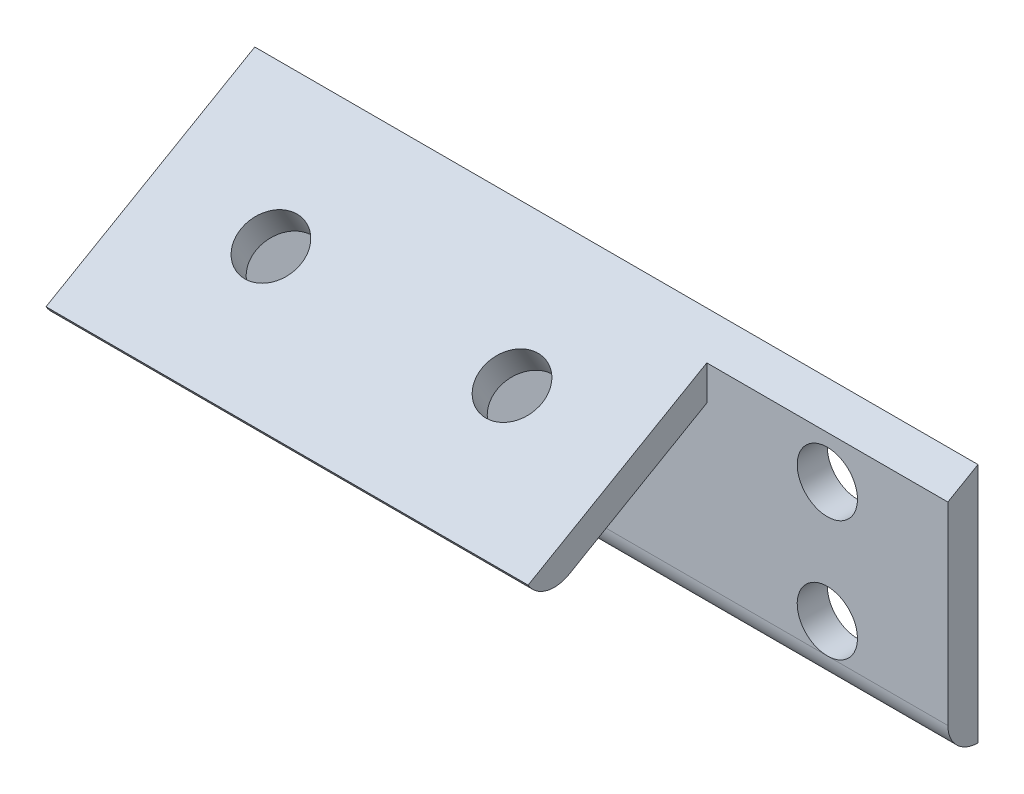
from build123d import *

# Parameters (mm, degrees)
BOSS_EXTRUDE1_DEPTH             = 76.2
CUT_EXTRUDE2_REACH              = 85.279
SKETCH3_W                       = 25.4
SKETCH3_H                       = 25.4
F_1_4_0_25_DIAMETER_HOLE1_D     = 6.35
F_1_4_0_25_DIAMETER_HOLE2_D     = 6.35
F_1_4_0_25_DIAMETER_HOLE2_DEPTH = 3.175


with BuildPart() as part:
    # Sketch1 → Boss-Extrude1 (new body)
    with BuildSketch(Plane(origin=(0, 0, 0), x_dir=(0, 0, -1), z_dir=(1, 0, 0))):
        with BuildLine():
            Line((0, 0), (0, -25.4))
            ThreePointArc((0, -25.4), (-2.24506403, -24.47006403), (-3.175, -22.225))
            Line((-3.175, -22.225), (-3.175, -5.499261314))
            Line((-3.175, -5.499261314), (-17.659914599, -13.862130657))
            ThreePointArc((-17.659914599, -13.862130657), (-20.069165067, -14.179314498), (-21.997045256, -12.7))
            Line((-21.997045256, -12.7), (0, 0))
        make_face()
    extrude(amount=BOSS_EXTRUDE1_DEPTH)

    # Sketch3 → Cut-Extrude2 (cut, up to next)
    with BuildSketch(Plane(origin=(0, 0, 0), x_dir=(1, 0, 0), z_dir=(0, 1, 0)), mode=Mode.PRIVATE) as cut_extrude2_sk1:
        with Locations((63.5, -15.875)):
            Rectangle(SKETCH3_W, SKETCH3_H)
    cut_extrude2_tool1 = extrude(cut_extrude2_sk1.sketch, amount=-CUT_EXTRUDE2_REACH, mode=Mode.PRIVATE) & part.part
    add(cut_extrude2_tool1.solids().sort_by_distance((63.5, 0, 15.875))[0], mode=Mode.SUBTRACT)

    # 1/4 (0.25) Diameter Hole1 (through all)
    with Locations(Plane.XY.offset(3.175)):
        with Locations((63.5, -6.35), (63.5, -19.05)):
            Hole(F_1_4_0_25_DIAMETER_HOLE1_D / 2)

    # 1/4 (0.25) Diameter Hole2
    with Locations(Plane(origin=(0, 0, 0), x_dir=(1, 0, 0), z_dir=(0, 0.8660254037844398, 0.49999999999999806))):
        with Locations((12.7, -12.7), (38.1, -12.7)):
            Hole(F_1_4_0_25_DIAMETER_HOLE2_D / 2, depth=F_1_4_0_25_DIAMETER_HOLE2_DEPTH)


solid = part.part
